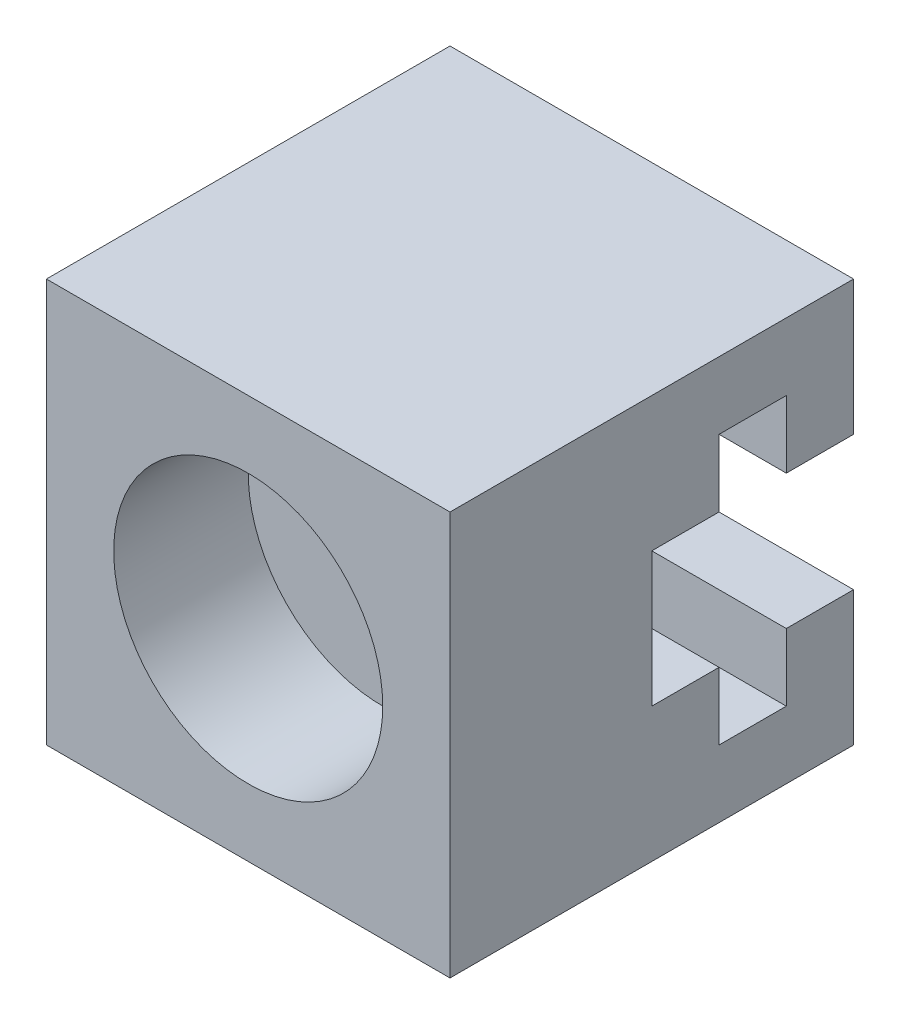
from build123d import *

# Parameters (mm, degrees)
BOSS_EXTRUDE1_DEPTH      = 75
BOSS_EXTRUDE1_DEPTH_BACK = 75
SKETCH4_R                = 50
CUT_EXTRUDE1_DEPTH       = 50


with BuildPart() as part:
    # Sketch2 → Boss-Extrude1 (new, two sides: drawn at the far end of the back side and taken through both)
    with BuildSketch(Plane(origin=(0, 0, 0), x_dir=(0, 0, -1), z_dir=(1, 0, 0)).offset(-BOSS_EXTRUDE1_DEPTH_BACK)):
        Polygon((75, 25), (50, 25), (50, 50), (25, 50), (25, 25), (0, 25), (0, -25), (25, -25), (25, -50), (50, -50), (50, -25), (75, -25), (75, -75), (-75, -75), (-75, 75), (75, 75), align=None)
    extrude(amount=BOSS_EXTRUDE1_DEPTH + BOSS_EXTRUDE1_DEPTH_BACK)

    # Sketch4 → Cut-Extrude1 (cut)
    with BuildSketch(Plane.XY.offset(75)):
        Circle(SKETCH4_R)
    extrude(amount=-CUT_EXTRUDE1_DEPTH, mode=Mode.SUBTRACT)


solid = part.part
